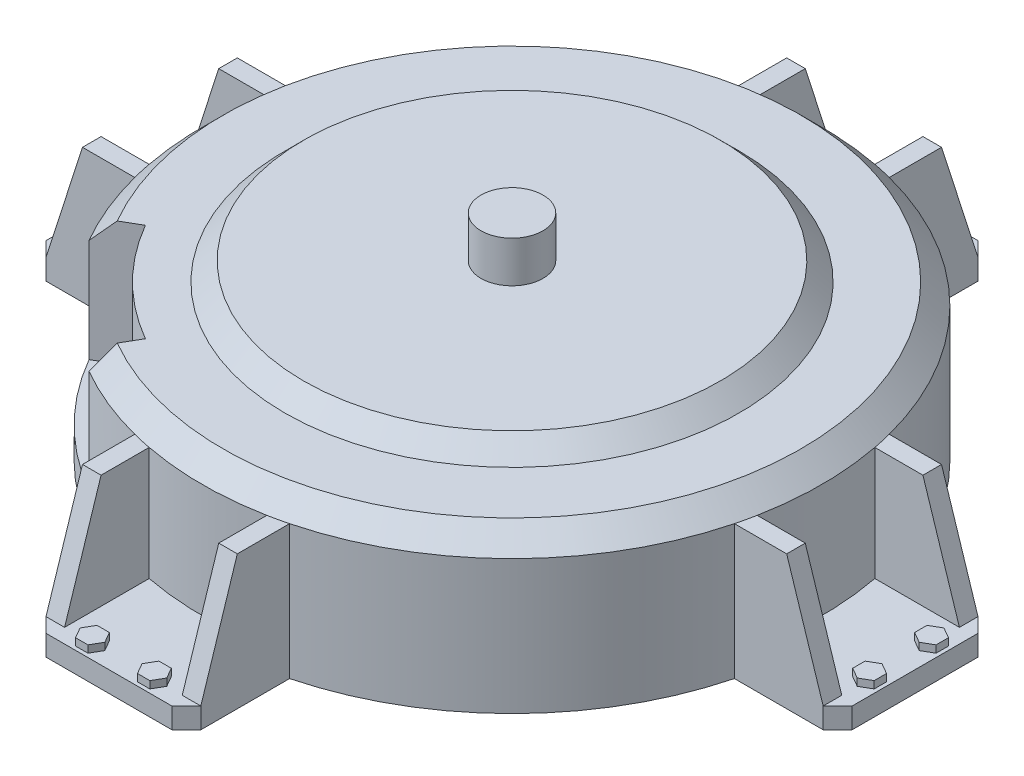
from build123d import *

# Parameters (mm, degrees)
SKETCH1_R                    = 150
BOSS_EXTRUDE1_DEPTH          = 75
CHAMFER1_SIZE                = 10
BOSS_EXTRUDE2_DEPTH          = 10
CHAMFER2_SIZE                = 7
BOSS_EXTRUDE3_DEPTH          = 9
BOSS_EXTRUDE4_DEPTH          = 3.5
CIRPATTERN1_COUNT            = 4
CIRPATTERN1_COPY_1_DEPTH     = 9
CIRPATTERN1_COPY_2_DEPTH     = 9
CIRPATTERN1_COPY_3_DEPTH     = 9
CIRPATTERN1_COPY_4_DEPTH     = 3.5
CIRPATTERN1_COPY_5_DEPTH     = 3.5
CIRPATTERN1_COPY_6_DEPTH     = 3.5
CHAMFER2_OF_CIRPATTERN1_SIZE = 7
SKETCH5_R                    = 110
BOSS_EXTRUDE5_DEPTH          = 9
BOSS_EXTRUDE5_TAPER          = 45
CUT_EXTRUDE1_START           = -60
CUT_EXTRUDE1_DEPTH           = 60
SKETCH7_R                    = 15
BOSS_EXTRUDE6_DEPTH          = 20
SKETCH8_R                    = 27.5
CUT_EXTRUDE2_DEPTH           = 60


with BuildPart() as part:
    # Sketch1 → Boss-Extrude1 (new body)
    with BuildSketch(Plane(origin=(0, 0, 0), x_dir=(1, 0, 0), z_dir=(0, 1, 0))):
        with Locations(Location((0, 0, 0), (0, 0, 270))):
            Circle(SKETCH1_R)
    extrude(amount=BOSS_EXTRUDE1_DEPTH)

    # Chamfer1
    chamfer1_edges = [part.edges().sort_by_distance(p)[0] for p in [
        (0, 75, -150),
    ]]
    chamfer(chamfer1_edges, length=CHAMFER1_SIZE)

    # Sketch2 → Boss-Extrude2 (add)
    with BuildSketch(Plane.XZ):
        with BuildLine():
            Line((145.236875483, 37.5), (195.236875483, 37.5))
            Line((195.236875483, 37.5), (195.236875483, -37.5))
            Line((195.236875483, -37.5), (145.236875483, -37.5))
            ThreePointArc((145.236875483, -37.5), (150, 0), (145.236875483, 37.5))
        make_face()
    boss_extrude2 = extrude(amount=-BOSS_EXTRUDE2_DEPTH)

    # Chamfer2
    chamfer2_edges = [part.edges().sort_by_distance(p)[0] for p in [
        (195.236875483, 5, 37.5),
        (195.236875483, 5, -37.5),
    ]]
    chamfer(chamfer2_edges, length=CHAMFER2_SIZE)

    # Sketch3 → Boss-Extrude3 (add)
    with BuildSketch(Plane(origin=(0, 0, -37.5), x_dir=(-1, 0, 0), z_dir=(0, 0, -1))):
        Polygon((-145.236875483, 10), (-145.236875483, 65), (-170.556875483, 65), (-188.236875483, 10), align=None)
    boss_extrude3 = extrude(amount=-BOSS_EXTRUDE3_DEPTH)

    # Sketch4 → Boss-Extrude4 (add)
    with BuildSketch(Plane(origin=(0, 10, 0), x_dir=(1, 0, 0), z_dir=(0, 1, 0))):
        Polygon((188.236875483, 21), (183.04072306, 18), (183.04072306, 12), (188.236875483, 9), (193.433027905, 12), (193.433027905, 18), align=None)
    boss_extrude4 = extrude(amount=BOSS_EXTRUDE4_DEPTH)

    # Mirror1: Boss-Extrude3, Boss-Extrude4 across plane
    add(boss_extrude3.mirror(Plane.XY))
    add(boss_extrude4.mirror(Plane.XY))

    # CirPattern1: Boss-Extrude2, Boss-Extrude3, Boss-Extrude4 ×4 about axis
    cirpattern1_axis = Axis((0, 0, 0), (0, 1, 0))
    add([boss_extrude2.rotate(cirpattern1_axis, i * 360 / CIRPATTERN1_COUNT) for i in range(1, CIRPATTERN1_COUNT)])
    add([boss_extrude3.rotate(cirpattern1_axis, i * 360 / CIRPATTERN1_COUNT) for i in range(1, CIRPATTERN1_COUNT)])
    add([boss_extrude4.rotate(cirpattern1_axis, i * 360 / CIRPATTERN1_COUNT) for i in range(1, CIRPATTERN1_COUNT)])

    # CirPattern1 copy 1 sketch → CirPattern1 copy 1 (add)
    with BuildSketch(Plane(origin=(37.5, 0, 0), x_dir=(0, 0, 1), z_dir=(1, 0, 0))):
        Polygon((-145.236875483, -10), (-145.236875483, -65), (-170.556875483, -65), (-188.236875483, -10), align=None)
    extrude(amount=-CIRPATTERN1_COPY_1_DEPTH)

    # CirPattern1 copy 2 sketch → CirPattern1 copy 2 (add)
    with BuildSketch(Plane(origin=(0, 0, -37.5), x_dir=(1, 0, 0), z_dir=(0, 0, -1))):
        Polygon((-145.236875483, -10), (-145.236875483, -65), (-170.556875483, -65), (-188.236875483, -10), align=None)
    extrude(amount=-CIRPATTERN1_COPY_2_DEPTH)

    # CirPattern1 copy 3 sketch → CirPattern1 copy 3 (add)
    with BuildSketch(Plane(origin=(-37.5, 0, 0), x_dir=(0, 0, -1), z_dir=(-1, 0, 0))):
        Polygon((-145.236875483, -10), (-145.236875483, -65), (-170.556875483, -65), (-188.236875483, -10), align=None)
    extrude(amount=-CIRPATTERN1_COPY_3_DEPTH)

    # CirPattern1 copy 4 sketch → CirPattern1 copy 4 (add)
    with BuildSketch(Plane(origin=(0, 10, 0), x_dir=(0, 0, -1), z_dir=(0, 1, 0))):
        Polygon((188.236875483, -21), (183.04072306, -18), (183.04072306, -12), (188.236875483, -9), (193.433027905, -12), (193.433027905, -18), align=None)
    extrude(amount=CIRPATTERN1_COPY_4_DEPTH)

    # CirPattern1 copy 5 sketch → CirPattern1 copy 5 (add)
    with BuildSketch(Plane(origin=(0, 10, 0), x_dir=(-1, 0, 0), z_dir=(0, 1, 0))):
        Polygon((188.236875483, -21), (183.04072306, -18), (183.04072306, -12), (188.236875483, -9), (193.433027905, -12), (193.433027905, -18), align=None)
    extrude(amount=CIRPATTERN1_COPY_5_DEPTH)

    # CirPattern1 copy 6 sketch → CirPattern1 copy 6 (add)
    with BuildSketch(Plane.ZX.offset(10)):
        Polygon((188.236875483, -21), (183.04072306, -18), (183.04072306, -12), (188.236875483, -9), (193.433027905, -12), (193.433027905, -18), align=None)
    extrude(amount=CIRPATTERN1_COPY_6_DEPTH)

    # Chamfer2 of CirPattern1
    chamfer2_of_cirpattern1_edges = [part.edges().sort_by_distance(p)[0] for p in [
        (37.5, 5, -195.236875483),
        (-37.5, 5, -195.236875483),
        (-195.236875483, 5, -37.5),
        (-195.236875483, 5, 37.5),
        (-37.5, 5, 195.236875483),
        (37.5, 5, 195.236875483),
    ]]
    chamfer(chamfer2_of_cirpattern1_edges, length=CHAMFER2_OF_CIRPATTERN1_SIZE)

    # Sketch5 → Boss-Extrude5 (add)
    with BuildSketch(Plane(origin=(0, 75, 0), x_dir=(1, 0, 0), z_dir=(0, 1, 0))):
        Circle(SKETCH5_R)
    extrude(amount=BOSS_EXTRUDE5_DEPTH, taper=BOSS_EXTRUDE5_TAPER)

    # Sketch6 → Cut-Extrude1 (cut)
    with BuildSketch(Plane(origin=(0, 75, 0), x_dir=(1, 0, 0), z_dir=(0, 1, 0)).offset(CUT_EXTRUDE1_START)):
        with BuildLine():
            Line((-112.583302492, -65), (-129.903810568, -75))
            ThreePointArc((-129.903810568, -75), (-106.066017178, -106.066017178), (-75, -129.903810568))
            Line((-75, -129.903810568), (-65, -112.583302492))
            ThreePointArc((-65, -112.583302492), (-91.923881554, -91.923881554), (-112.583302492, -65))
        make_face()
    extrude(amount=CUT_EXTRUDE1_DEPTH, mode=Mode.SUBTRACT)

    # Sketch7 → Boss-Extrude6 (add)
    with BuildSketch(Plane(origin=(0, 84, 0), x_dir=(1, 0, 0), z_dir=(0, 1, 0))):
        with Locations(Location((0, 0, 0), (0, 0, 270))):
            Circle(SKETCH7_R)
    extrude(amount=BOSS_EXTRUDE6_DEPTH)

    # Sketch8 → Cut-Extrude2 (cut)
    with BuildSketch(Plane.XZ):
        with Locations(Location((0, 0, 0), (0, 0, 270))):
            Circle(SKETCH8_R)
    extrude(amount=-CUT_EXTRUDE2_DEPTH, mode=Mode.SUBTRACT)


solid = part.part
